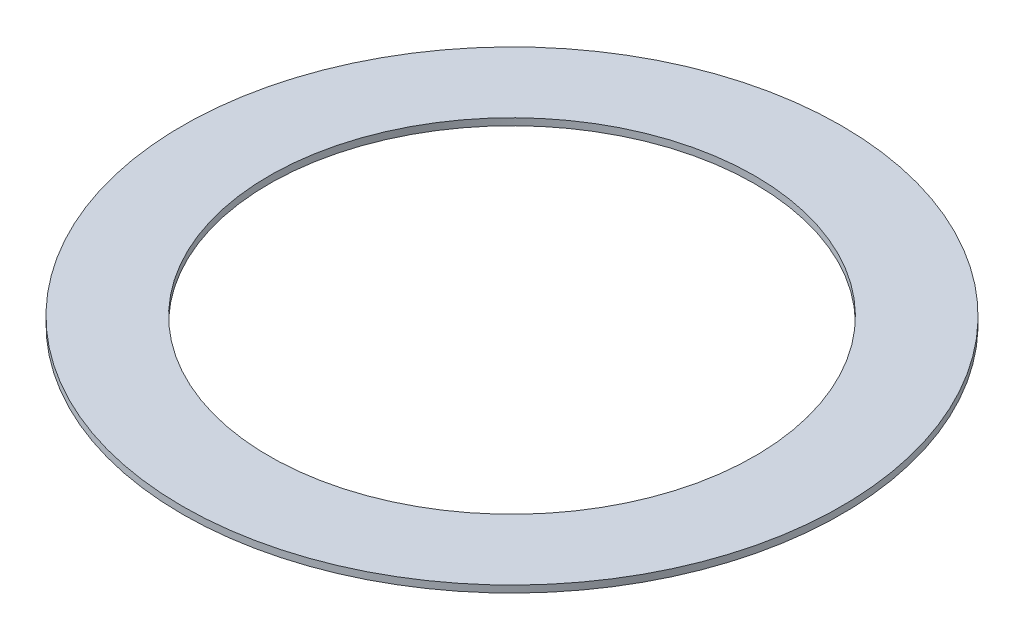
from build123d import *

# Parameters (mm, degrees)
SKIZZE1_W = 12.5
SKIZZE1_H = 1


with BuildPart() as part:
    # Skizze1 → Rotation1 (revolve)
    with BuildSketch(Plane.XY, mode=Mode.PRIVATE) as rotation1_sk:
        with Locations((41.25, 0.5)):
            Rectangle(SKIZZE1_W, SKIZZE1_H)
    revolve(rotation1_sk.sketch.rotate(Axis((0, 0, 0), (0, 1, 0)), 90), axis=Axis((0, 0, 0), (0, 1, 0)))


solid = part.part
